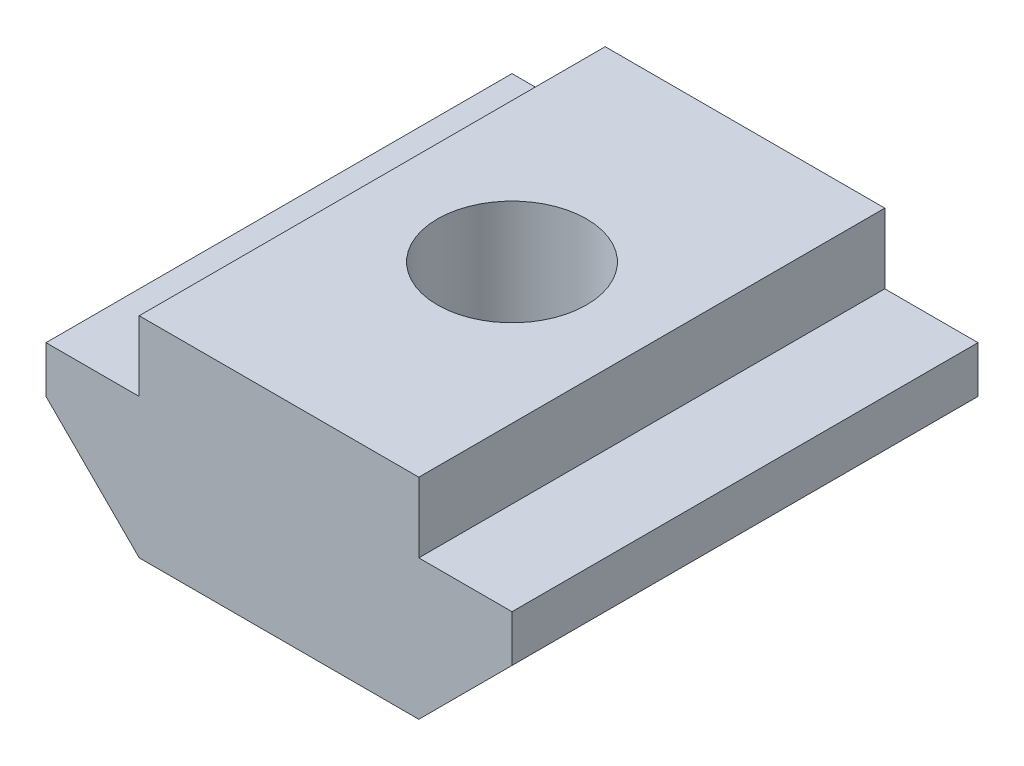
from build123d import *

# Parameters (mm, degrees)
SKETCH_1_W          = 10
SKETCH_1_H          = 3
SKETCH_1_W_2        = 6
EXTRUDE_1_DEPTH     = 5
SKETCH_2_R          = 1.6
CUT_EXTRUDE_1_DEPTH = 10
CHAMFER_1_SIZE      = 2


with BuildPart() as part:
    # 草图1 → 凸台-拉伸1 (new, symmetric)
    with BuildSketch(Plane.XY):
        Rectangle(SKETCH_1_W, SKETCH_1_H)
        with Locations((0, 1.5)):
            Rectangle(SKETCH_1_W_2, SKETCH_1_H)
    extrude(amount=EXTRUDE_1_DEPTH, both=True)

    # 草图2 → 切除-拉伸1 (cut)
    with BuildSketch(Plane(origin=(0, 3, 0), x_dir=(1, 0, 0), z_dir=(0, 1, 0))):
        with Locations(Location((0, 0, 0), (0, 0, 270))):
            Circle(SKETCH_2_R)
    extrude(amount=-CUT_EXTRUDE_1_DEPTH, mode=Mode.SUBTRACT)

    # 倒角1
    chamfer_1_edges = [part.edges().sort_by_distance(p)[0] for p in [
        (5, -1.5, 0),
        (-5, -1.5, 0),
    ]]
    chamfer(chamfer_1_edges, length=CHAMFER_1_SIZE)


solid = part.part
